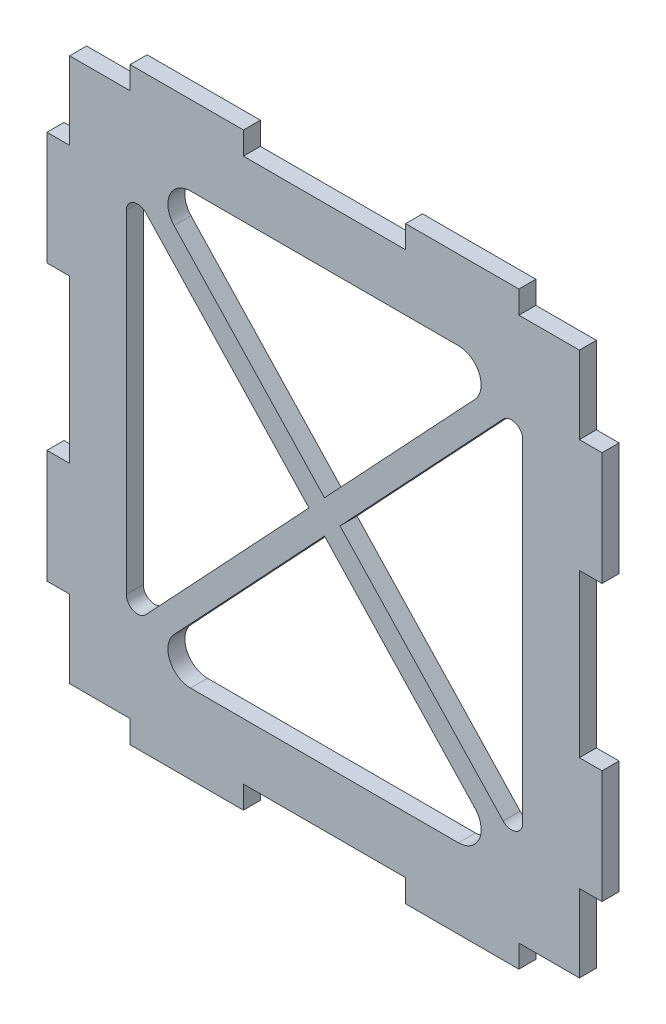
from build123d import *

# Parameters (mm, degrees)
EXTRUDE_1_DEPTH = 1.5


with BuildPart() as part:
    # 草图1 → 凸台-拉伸1 (new body)
    with BuildSketch(Plane.XY):
        Polygon((2296.848886703, 1258.899784257), (2296.848886703, 1260.899784257), (2286.848886703, 1260.899784257), (2286.848886703, 1258.899784257), (2281.507070967, 1258.899784257), (2281.507070967, 1252.057968521), (2279.507070967, 1252.057968521), (2279.507070967, 1242.057968521), (2281.507070967, 1242.057968521), (2281.507070967, 1227.741599993), (2279.507070967, 1227.741599993), (2279.507070967, 1217.741599993), (2281.507070967, 1217.741599993), (2281.507070967, 1210.899784257), (2286.848886703, 1210.899784257), (2286.848886703, 1208.899784257), (2296.848886703, 1208.899784257), (2296.848886703, 1210.899784257), (2311.165255231, 1210.899784257), (2311.165255231, 1208.899784257), (2321.165255231, 1208.899784257), (2321.165255231, 1210.899784257), (2326.507070967, 1210.899784257), (2326.507070967, 1217.741599993), (2328.507070967, 1217.741599993), (2328.507070967, 1227.741599993), (2326.507070967, 1227.741599993), (2326.507070967, 1242.057968521), (2328.507070967, 1242.057968521), (2328.507070967, 1252.057968521), (2326.507070967, 1252.057968521), (2326.507070967, 1258.899784257), (2321.165255231, 1258.899784257), (2321.165255231, 1260.899784257), (2311.165255231, 1260.899784257), (2311.165255231, 1258.899784257), (2304.007070967, 1258.899784257), align=None)
        with BuildLine():
            ThreePointArc((2286.507070967, 1249.575559728), (2287.139332676, 1250.505489053), (2288.236608066, 1250.259500969))
            Line((2288.236608066, 1250.259500969), (2302.636365199, 1234.899764783))
            Line((2302.636365199, 1234.899764783), (2288.21378563, 1219.515654308))
            ThreePointArc((2288.21378563, 1219.515654308), (2287.124283961, 1219.299885135), (2286.507473515, 1220.223527434))
            Line((2286.507473515, 1220.223527434), (2286.507070967, 1249.575559728))
        make_face(mode=Mode.SUBTRACT)
        with BuildLine():
            Line((2290.723117316, 1219.267300568), (2304.007052849, 1233.437698409))
            Line((2304.007052849, 1233.437698409), (2317.335840115, 1219.220329728))
            ThreePointArc((2317.335840115, 1219.220329728), (2317.655344671, 1217.075780213), (2315.833356966, 1215.900392367))
            Line((2315.833356966, 1215.900392367), (2292.182284313, 1215.899458558))
            ThreePointArc((2292.182284313, 1215.899458558), (2290.347072244, 1217.104349752), (2290.723117316, 1219.267300568))
        make_face(mode=Mode.SUBTRACT)
        with BuildLine():
            ThreePointArc((2319.77790316, 1250.259120778), (2320.862789914, 1250.509889131), (2321.507070967, 1249.601722869))
            Line((2321.507070967, 1249.601722869), (2321.507070967, 1220.185997989))
            ThreePointArc((2321.507070967, 1220.185997989), (2320.857447426, 1219.287966637), (2319.778324446, 1219.540878969))
            Line((2319.778324446, 1219.540878969), (2305.377777603, 1234.89980238))
            Line((2305.377777603, 1234.89980238), (2319.77790316, 1250.259120778))
        make_face(mode=Mode.SUBTRACT)
        with BuildLine():
            Line((2304.007088097, 1236.36187164), (2290.722688538, 1250.531902224))
            ThreePointArc((2290.722688538, 1250.531902224), (2290.346584138, 1252.694842725), (2292.181763157, 1253.899784257))
            Line((2292.181763157, 1253.899784257), (2315.832835828, 1253.899499172))
            ThreePointArc((2315.832835828, 1253.899499172), (2317.659143856, 1252.714620558), (2317.32152184, 1250.563957934))
            Line((2317.32152184, 1250.563957934), (2304.007088097, 1236.36187164))
        make_face(mode=Mode.SUBTRACT)
    extrude(amount=EXTRUDE_1_DEPTH)


solid = part.part
